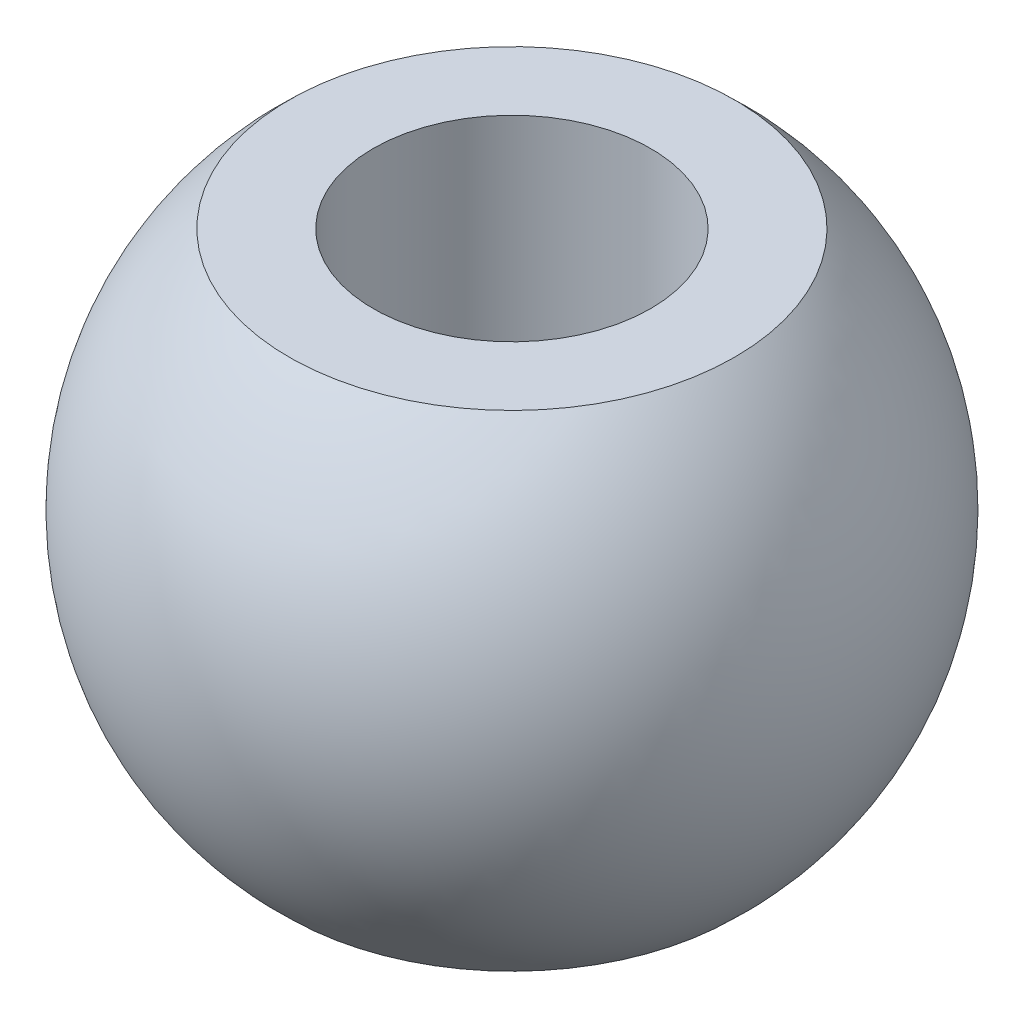
from build123d import *


with BuildPart() as part:
    # Эскиз3 → Revolve 491 (revolve)
    with BuildSketch(Plane.XY):
        with BuildLine():
            Line((2, 3.5), (2, -3.5))
            Line((2, -3.5), (3.211308145, -3.5))
            ThreePointArc((3.211308145, -3.5), (4.75, 0), (3.211308145, 3.5))
            Line((3.211308145, 3.5), (2, 3.5))
        make_face()
    revolve(axis=Axis((0, 3.5, 0), (0, -1, 0)))


solid = part.part
